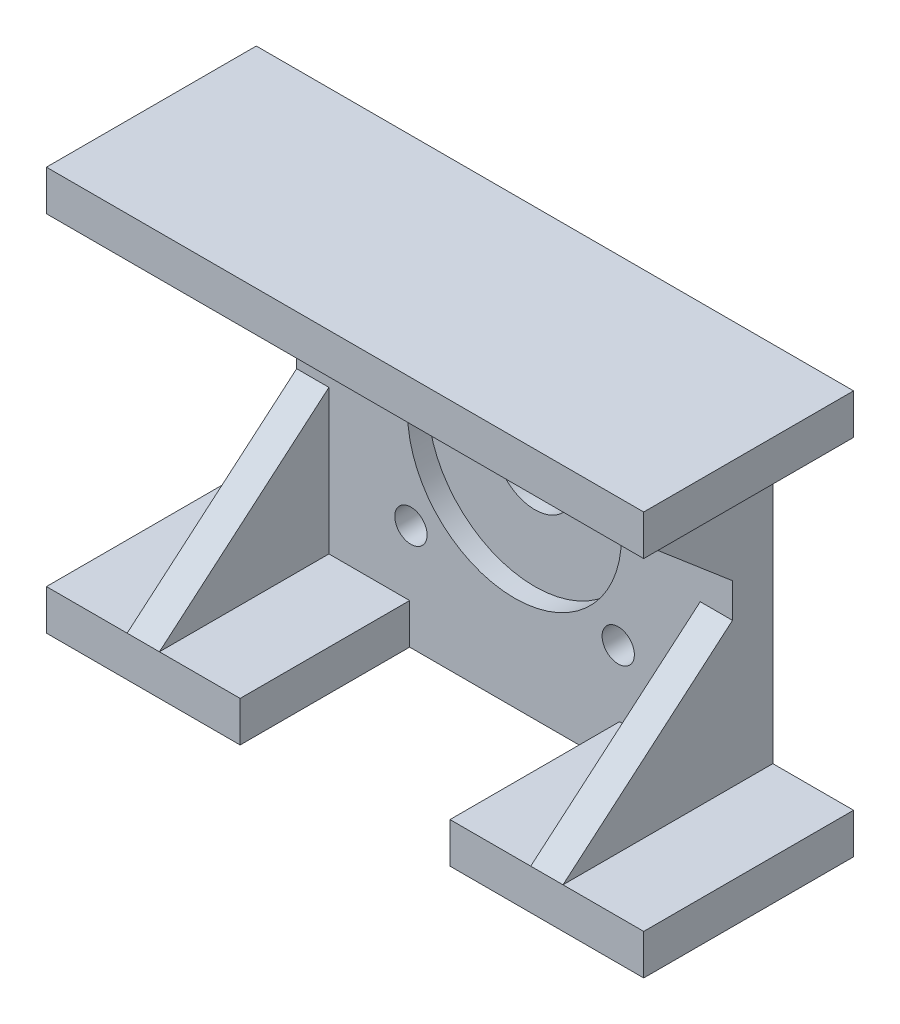
from build123d import *

# Parameters (mm, degrees)
SKETCH2_W           = 54
SKETCH2_H           = 50
SKETCH2_R           = 5
SKETCH2_R_2         = 2
BOSS_EXTRUDE1_DEPTH = 5
SKETCH3_W           = 74
SKETCH3_H           = 5
SKETCH3_W_2         = 24
BOSS_EXTRUDE2_DEPTH = 21
SKETCH3_3_W         = 74
SKETCH3_3_H         = 5
BOSS_EXTRUDE3_DEPTH = 5
SKETCH3_4_W         = 10
SKETCH3_4_H         = 5
BOSS_EXTRUDE4_DEPTH = 5
SKETCH4_R           = 13.25
CUT_EXTRUDE1_DEPTH  = 2.5
BOSS_EXTRUDE7_DEPTH = 4
BOSS_EXTRUDE8_START = -50
BOSS_EXTRUDE8_DEPTH = 4


with BuildPart() as part:
    # Sketch2 → Boss-Extrude1 (new body)
    with BuildSketch(Plane.XY):
        Rectangle(SKETCH2_W, SKETCH2_H)
        Circle(SKETCH2_R, mode=Mode.SUBTRACT)
        with Locations((-12.840811795, 11.889640551)):
            Circle(SKETCH2_R_2, mode=Mode.SUBTRACT)
        with Locations((-12.840811795, -11.889640551)):
            Circle(SKETCH2_R_2, mode=Mode.SUBTRACT)
        with Locations((12.840811795, -11.889640551)):
            Circle(SKETCH2_R_2, mode=Mode.SUBTRACT)
        with Locations((12.840811795, 11.889640551)):
            Circle(SKETCH2_R_2, mode=Mode.SUBTRACT)
    extrude(amount=BOSS_EXTRUDE1_DEPTH)

    # Sketch3 → Boss-Extrude2 (add)
    with BuildSketch(Plane.XY.offset(5)):
        with Locations((0, 22.5)):
            Rectangle(SKETCH3_W, SKETCH3_H)
        with Locations((-25, -22.5)):
            Rectangle(SKETCH3_W_2, SKETCH3_H)
        with Locations((25, -22.5)):
            Rectangle(SKETCH3_W_2, SKETCH3_H)
    extrude(amount=BOSS_EXTRUDE2_DEPTH)

    # Sketch3<3> → Boss-Extrude3 (add)
    with BuildSketch(Plane.XY.offset(5)):
        with Locations((0, 22.5)):
            Rectangle(SKETCH3_3_W, SKETCH3_3_H)
    extrude(amount=-BOSS_EXTRUDE3_DEPTH)

    # Sketch3<4> → Boss-Extrude4 (add)
    with BuildSketch(Plane.XY.offset(5)):
        with Locations((32, -22.5)):
            Rectangle(SKETCH3_4_W, SKETCH3_4_H)
        with Locations((-32, -22.5)):
            Rectangle(SKETCH3_4_W, SKETCH3_4_H)
    extrude(amount=-BOSS_EXTRUDE4_DEPTH)

    # Sketch4 → Cut-Extrude1 (cut)
    with BuildSketch(Plane.XY.offset(5)):
        Circle(SKETCH4_R)
    extrude(amount=-CUT_EXTRUDE1_DEPTH, mode=Mode.SUBTRACT)

    # Sketch5 → Boss-Extrude7 (add)
    with BuildSketch(Plane(origin=(27, 0, 0), x_dir=(0, 0, -1), z_dir=(1, 0, 0))):
        Polygon((-26, 20), (-5, 2.126814834), (-5, 20), align=None)
        Polygon((-26, -20), (-5, -20), (-5, -2.126814834), align=None)
    extrude(amount=-BOSS_EXTRUDE7_DEPTH)

    # Sketch5<2> → Boss-Extrude8 (add)
    with BuildSketch(Plane(origin=(27, 0, 0), x_dir=(0, 0, -1), z_dir=(1, 0, 0)).offset(BOSS_EXTRUDE8_START)):
        Polygon((-26, 20), (-5, 2.126814834), (-5, 20), align=None)
        Polygon((-26, -20), (-5, -20), (-5, -2.126814834), align=None)
    extrude(amount=-BOSS_EXTRUDE8_DEPTH)


solid = part.part
